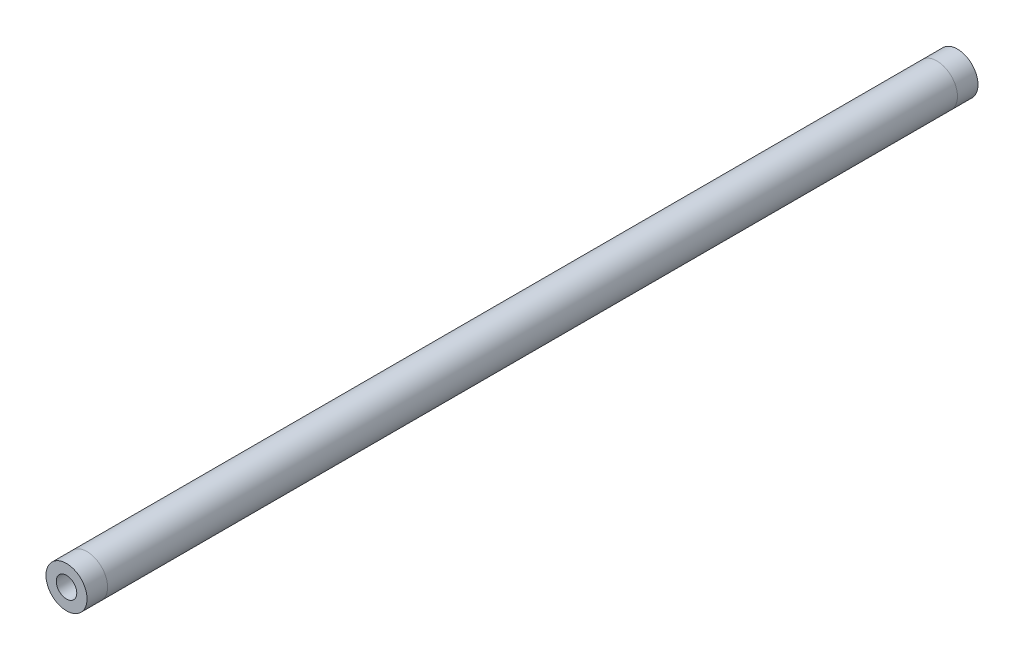
from build123d import *

# Parameters (mm, degrees)
SKETCH1_R                 = 6.35
SKETCH1_R_2               = 4.826
SKETCH1_R_3               = 3.175
THREADED_INSERT_1_1_DEPTH = 6.35
THREADED_START            = -6.35
SKETCH1_3_R               = 4.826
SKETCH1_3_R_2             = 3.175
THREADED_INSERT_1_2_DEPTH = 9.525
TUBE_START                = -6.35
SKETCH1_4_R               = 6.35
SKETCH1_4_R_2             = 4.826
TUBE_EXTRUDE_DEPTH        = 262.689418
THREADED_START_2          = -269.039418
SKETCH1_6_R               = 4.826
SKETCH1_6_R_2             = 3.175
THREADED_INSERT_2_1_DEPTH = 9.525
SKETCH1_9_R               = 6.35
SKETCH1_9_R_2             = 4.826
SKETCH1_9_R_3             = 3.175
THREADED_INSERT_2_2_DEPTH = 6.35


with BuildPart() as part:
    # Sketch1 → Threaded insert 1-1 (new body)
    # profile 1 of 2: a face of its own
    with BuildSketch(Plane.XY):
        Circle(SKETCH1_R)
        Circle(SKETCH1_R_2, mode=Mode.SUBTRACT)
    # profile 2 of 2: a face of its own
    with BuildSketch(Plane.XY):
        Circle(SKETCH1_R_2)
        Circle(SKETCH1_R_3, mode=Mode.SUBTRACT)
    extrude(amount=-THREADED_INSERT_1_1_DEPTH)

    # Sketch1<3> → Threaded insert 1-2 (add)
    with BuildSketch(Plane.XY.offset(THREADED_START)):
        Circle(SKETCH1_3_R)
        Circle(SKETCH1_3_R_2, mode=Mode.SUBTRACT)
    extrude(amount=-THREADED_INSERT_1_2_DEPTH)


with BuildPart() as body_2:
    # Sketch1<4> → Tube extrude (new body)
    with BuildSketch(Plane.XY.offset(TUBE_START)):
        Circle(SKETCH1_4_R)
        Circle(SKETCH1_4_R_2, mode=Mode.SUBTRACT)
    extrude(amount=-TUBE_EXTRUDE_DEPTH)


with BuildPart() as body_3:
    # Sketch1<6> → Threaded insert 2-1 (new body)
    with BuildSketch(Plane.XY.offset(THREADED_START_2)):
        Circle(SKETCH1_6_R)
        Circle(SKETCH1_6_R_2, mode=Mode.SUBTRACT)
    extrude(amount=THREADED_INSERT_2_1_DEPTH)


with BuildPart() as body_4:
    # Sketch1<9> → Threaded insert 2-2 (new body)
    # profile 1 of 2: a face of its own
    with BuildSketch(Plane.XY.offset(THREADED_START_2)):
        Circle(SKETCH1_9_R)
        Circle(SKETCH1_9_R_2, mode=Mode.SUBTRACT)
    # profile 2 of 2: a face of its own
    with BuildSketch(Plane.XY.offset(THREADED_START_2)):
        Circle(SKETCH1_9_R_2)
        Circle(SKETCH1_9_R_3, mode=Mode.SUBTRACT)
    extrude(amount=-THREADED_INSERT_2_2_DEPTH)

    # Combine1: union body 3
    add(body_3.part)


solid = Compound([part.part, body_2.part, body_4.part])
